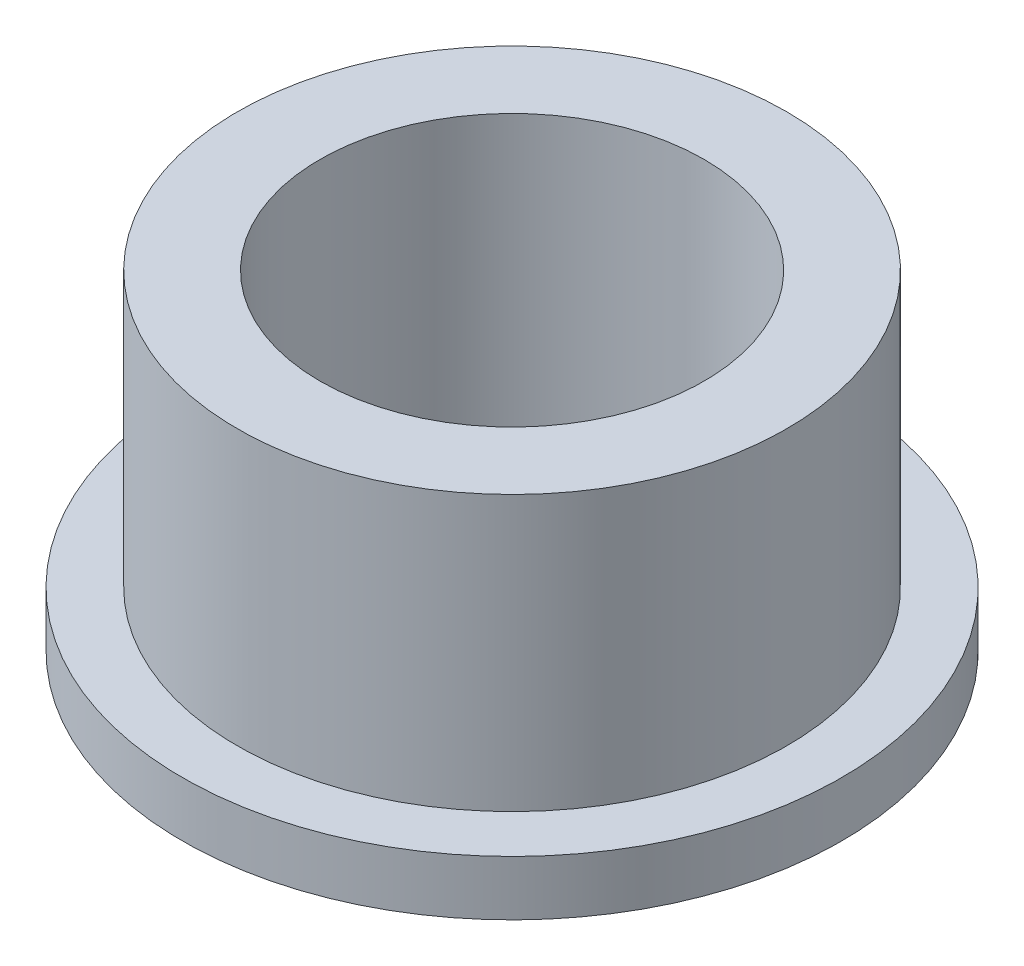
from build123d import *

# Parameters (mm, degrees)
SKETCH1_R           = 15.875
SKETCH1_R_2         = 11.102417862
BOSS_EXTRUDE1_DEPTH = 19.05
SKETCH2_R           = 19.05
SKETCH2_R_2         = 15.875
BOSS_EXTRUDE2_DEPTH = 3.175


with BuildPart() as part:
    # Sketch1 → Boss-Extrude1 (new body)
    with BuildSketch(Plane(origin=(0, 0, 0), x_dir=(1, 0, 0), z_dir=(0, 1, 0))):
        with Locations(Location((0, 0, 0), (0, 0, 90))):
            Circle(SKETCH1_R)
        with Locations(Location((0, 0, 0), (0, 0, 90))):
            Circle(SKETCH1_R_2, mode=Mode.SUBTRACT)
    extrude(amount=BOSS_EXTRUDE1_DEPTH)

    # Sketch2 → Boss-Extrude2 (add)
    with BuildSketch(Plane.XZ):
        with Locations(Location((0, 0, 0), (0, 0, 270))):
            Circle(SKETCH2_R)
        with Locations(Location((0, 0, 0), (0, 0, 270))):
            Circle(SKETCH2_R_2, mode=Mode.SUBTRACT)
    extrude(amount=-BOSS_EXTRUDE2_DEPTH)


solid = part.part
